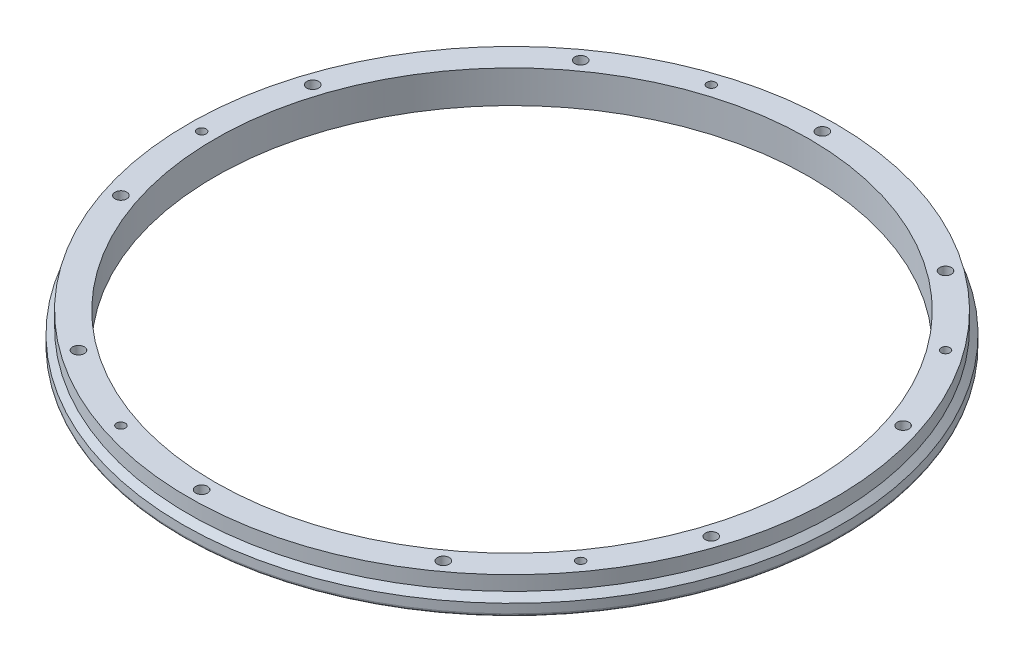
from build123d import *

# Parameters (mm, degrees)
SKETCH4_R          = 2
CUT_EXTRUDE1_DEPTH = 6
SKETCH5_R          = 1.5
CUT_EXTRUDE2_DEPTH = 159.778667329
SKETCH6_R          = 3.5
CUT_EXTRUDE3_DEPTH = 6.4


with BuildPart() as part:
    # Sketch3 (on Front Plane) → Revolve7 (revolve)
    with BuildSketch(Plane.XY, mode=Mode.PRIVATE) as revolve7_sk:
        with BuildLine():
            Line((-111, -28), (-101, -28))
            Line((-101, -28), (-101, -16.924568901))
            Line((-101, -16.924568901), (-109.95, -16.924568901))
            Line((-109.95, -16.924568901), (-109.95, -21.849137803))
            Line((-109.95, -21.849137803), (-112, -23.899137803))
            Line((-112, -23.899137803), (-112, -27))
            ThreePointArc((-112, -27), (-111.707106781, -27.707106781), (-111, -28))
        make_face()
    revolve(revolve7_sk.sketch.rotate(Axis((0, 0, 0), (0, 1, 0)), 270), axis=Axis((0, 0, 0), (0, 1, 0)))

    # Sketch4 → Cut-Extrude1 (cut)
    with BuildSketch(Plane(origin=(0, -16.924568901, 0), x_dir=(1, 0, 0), z_dir=(0, 1, 0))):
        with Locations(Location((0, 105.475, 0), (0, 0, 270))):
            Circle(SKETCH4_R)
        with Locations(Location((61.996649486, 85.331067482, 0), (0, 0, 270))):
            Circle(SKETCH4_R)
        with Locations(Location((100.312686056, 32.593567482, 0), (0, 0, 270))):
            Circle(SKETCH4_R)
        with Locations(Location((100.312686056, -32.593567482, 0), (0, 0, 270))):
            Circle(SKETCH4_R)
        with Locations(Location((61.996649486, -85.331067482, 0), (0, 0, 270))):
            Circle(SKETCH4_R)
        with Locations(Location((0, -105.475, 0), (0, 0, 270))):
            Circle(SKETCH4_R)
        with Locations(Location((-61.996649486, -85.331067482, 0), (0, 0, 270))):
            Circle(SKETCH4_R)
        with Locations(Location((-100.312686056, -32.593567482, 0), (0, 0, 270))):
            Circle(SKETCH4_R)
        with Locations(Location((-100.312686056, 32.593567482, 0), (0, 0, 270))):
            Circle(SKETCH4_R)
        with Locations(Location((-61.996649486, 85.331067482, 0), (0, 0, 270))):
            Circle(SKETCH4_R)
    extrude(amount=-CUT_EXTRUDE1_DEPTH, mode=Mode.SUBTRACT)

    # Sketch5 → Cut-Extrude2 (cut, through all)
    with BuildSketch(Plane(origin=(0, -16.924568901, 0), x_dir=(1, 0, 0), z_dir=(0, 1, 0))):
        with Locations(Location((-105.475, 0, 0), (0, 0, 270))):
            Circle(SKETCH5_R)
        with Locations(Location((-32.593567482, 100.312686056, 0), (0, 0, 270))):
            Circle(SKETCH5_R)
        with Locations(Location((85.331067482, 61.996649486, 0), (0, 0, 270))):
            Circle(SKETCH5_R)
        with Locations(Location((85.331067482, -61.996649486, 0), (0, 0, 270))):
            Circle(SKETCH5_R)
        with Locations(Location((-32.593567482, -100.312686056, 0), (0, 0, 270))):
            Circle(SKETCH5_R)
    extrude(amount=-CUT_EXTRUDE2_DEPTH, mode=Mode.SUBTRACT)

    # Sketch6 → Cut-Extrude3 (cut)
    with BuildSketch(Plane.XZ.offset(28)):
        with Locations(Location((-105.475, 0, 0), (0, 0, 270))):
            Circle(SKETCH6_R)
        with Locations(Location((-32.593567482, 100.312686056, 0), (0, 0, 270))):
            Circle(SKETCH6_R)
        with Locations(Location((85.331067482, 61.996649486, 0), (0, 0, 270))):
            Circle(SKETCH6_R)
        with Locations(Location((85.331067482, -61.996649486, 0), (0, 0, 270))):
            Circle(SKETCH6_R)
        with Locations(Location((-32.593567482, -100.312686056, 0), (0, 0, 270))):
            Circle(SKETCH6_R)
    extrude(amount=-CUT_EXTRUDE3_DEPTH, mode=Mode.SUBTRACT)


solid = part.part
